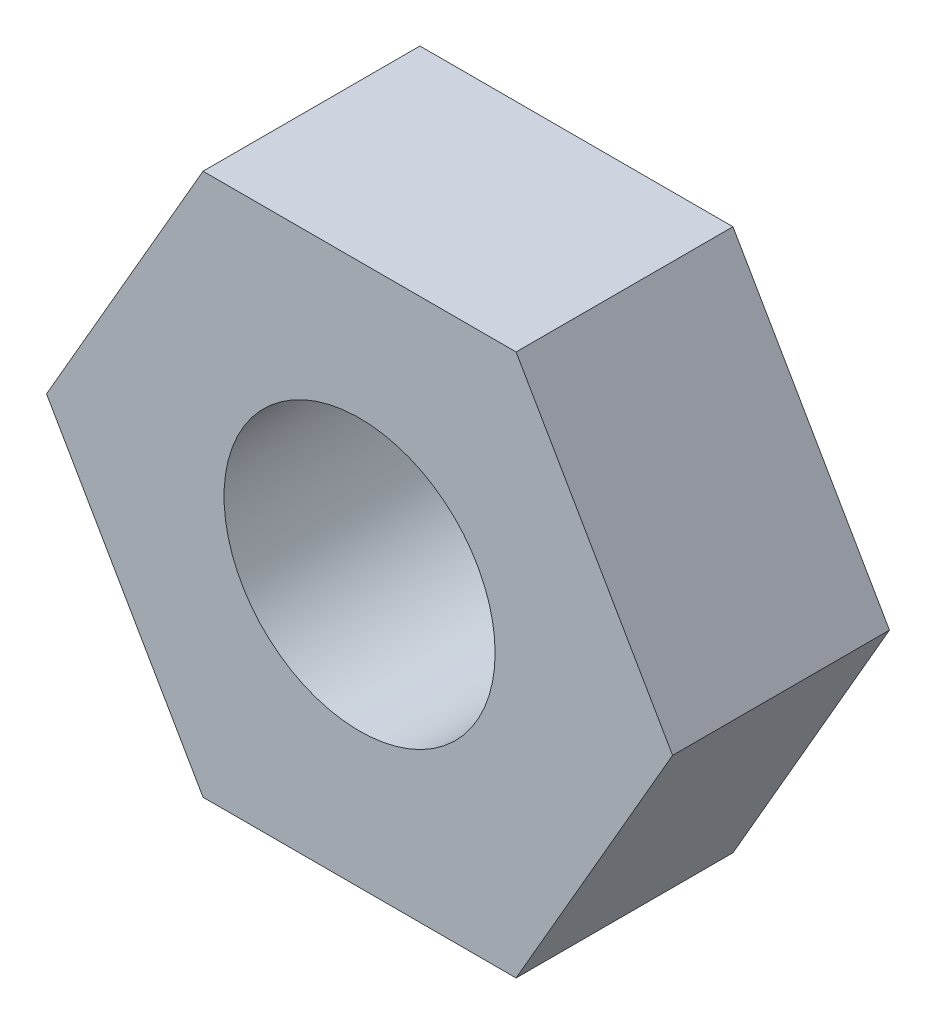
from build123d import *

# Parameters (mm, degrees)
BOSS_EXTRUDE1_DEPTH = 1.6
SKETCH3_R           = 1
CUT_EXTRUDE1_DEPTH  = 1.6


with BuildPart() as part:
    # Sketch2 → Boss-Extrude1 (new body)
    with BuildSketch(Plane.XY):
        Polygon((2.309401077, 0), (1.154700538, 2), (-1.154700538, 2), (-2.309401077, 0), (-1.154700538, -2), (1.154700538, -2), align=None)
    extrude(amount=BOSS_EXTRUDE1_DEPTH)

    # Sketch3 → Cut-Extrude1 (cut)
    with BuildSketch(Plane.XY.offset(1.6)):
        Circle(SKETCH3_R)
    extrude(amount=-CUT_EXTRUDE1_DEPTH, mode=Mode.SUBTRACT)


solid = part.part
